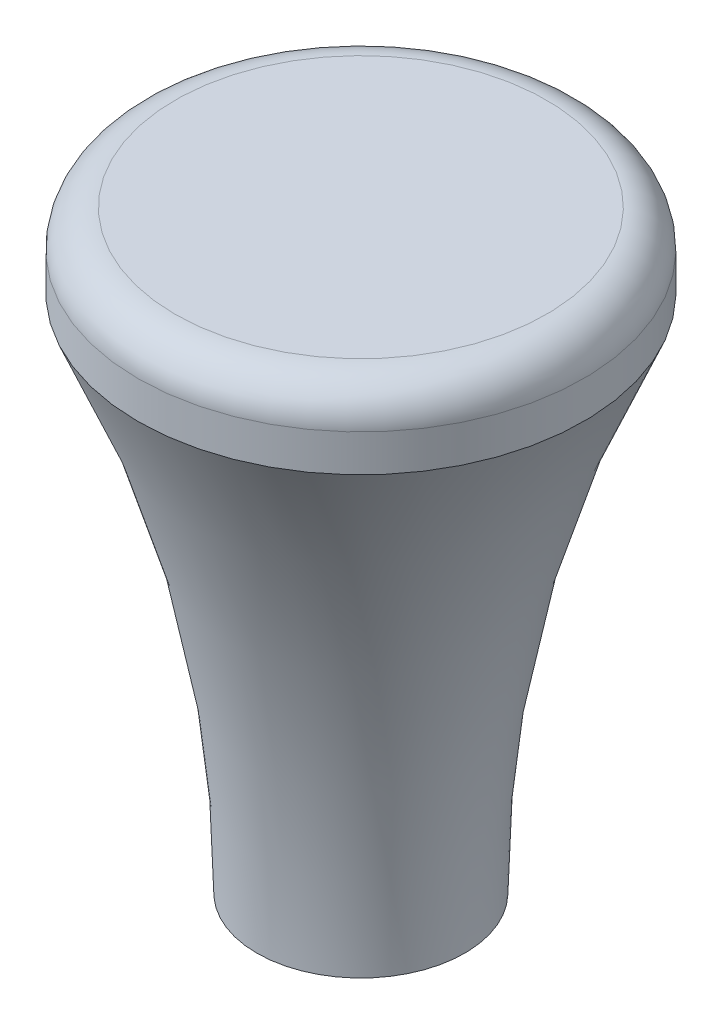
from build123d import *

# Parameters (mm, degrees)
SKETCH2_R          = 1
CUT_EXTRUDE1_DEPTH = 5


with BuildPart() as part:
    # Sketch1 → Revolve1 (revolve)
    with BuildSketch(Plane(origin=(0, 0, 0), x_dir=(0, 0, -1), z_dir=(1, 0, 0))):
        with BuildLine():
            Line((-7, -19.250050998), (0, -19.250050998))
            Line((0, -19.250050998), (0, 20.749949002))
            Line((0, 20.749949002), (-12.5, 20.749949002))
            ThreePointArc((-12.5, 20.749949002), (-14.267766953, 20.017715955), (-15, 18.249949002))
            Line((-15, 18.249949002), (-15, 15.749949002))
            ThreePointArc((-15, 15.749949002), (-9.025461564, -1.298727927), (-7, -19.250050998))
        make_face()
    revolve(axis=Axis((0, 28.85, 0), (0, -1, 0)))

    # Sketch2 → Cut-Extrude1 (cut)
    with BuildSketch(Plane.XZ.offset(19.250050998)):
        with Locations(Location((0, 0, 0), (0, 0, 270))):
            Circle(SKETCH2_R)
    extrude(amount=-CUT_EXTRUDE1_DEPTH, mode=Mode.SUBTRACT)


solid = part.part
